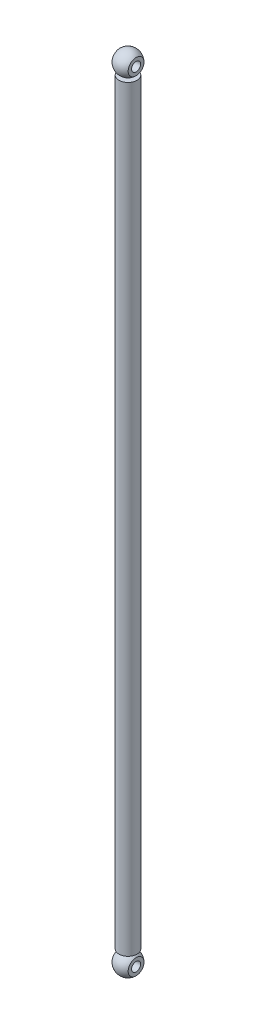
from build123d import *

# Parameters (mm, degrees)
SKETCH_1_W          = 4
SKETCH_1_H          = 334
SKETCH_3_W          = 5.137829835
SKETCH_3_H          = 13.006561537
CUT_EXTRUDE_1_DEPTH = 5
SKETCH_3_3_W        = 5.137829835
SKETCH_3_3_H        = 13.006561537
CUT_EXTRUDE_3_DEPTH = 5
SKETCH_4_R          = 2
CUT_EXTRUDE_4_DEPTH = 10


with BuildPart() as part:
    # 草圖1 → 旋轉1 (revolve)
    with BuildSketch(Plane.XY, mode=Mode.PRIVATE) as revolve_1_sk:
        with Locations((2, 167)):
            Rectangle(SKETCH_1_W, SKETCH_1_H)
    revolve(revolve_1_sk.sketch.rotate(Axis((0, 0, 0), (0, 1, 0)), 90), axis=Axis((0, 0, 0), (0, 1, 0)))


with BuildPart() as body_2:
    # 草圖2 → 旋轉2 (revolve)
    with BuildSketch(Plane.XY):
        with BuildLine():
            Line((0, 0), (0, -10))
            ThreePointArc((0, -10), (5, -5), (0, 0))
        make_face()
        with BuildLine():
            Line((0, 334), (0, 344))
            ThreePointArc((0, 344), (5, 339), (0, 334))
        make_face()
    revolve(axis=Axis((0, 347.589463941, 0), (0, -1, 0)))

    # 草圖3 → 除料-伸長1 (cut, symmetric)
    with BuildSketch(Plane.XY):
        with Locations((-6.143176149, 340.503280769)):
            Rectangle(SKETCH_3_W, SKETCH_3_H)
        with Locations((6.143176149, 340.503280769)):
            Rectangle(SKETCH_3_W, SKETCH_3_H)
    extrude(amount=CUT_EXTRUDE_1_DEPTH, both=True, mode=Mode.SUBTRACT)

    # 草圖3<3> → 除料-伸長3 (cut, symmetric)
    with BuildSketch(Plane.XY):
        with Locations((-6.143176149, 340.503280769)):
            Rectangle(SKETCH_3_3_W, SKETCH_3_3_H)
        with Locations((6.143176149, 340.503280769)):
            Rectangle(SKETCH_3_3_W, SKETCH_3_3_H)
        with Locations((-6.143176149, -6.503280769)):
            Rectangle(SKETCH_3_3_W, SKETCH_3_3_H)
        with Locations((6.143176149, -6.503280769)):
            Rectangle(SKETCH_3_3_W, SKETCH_3_3_H)
    extrude(amount=CUT_EXTRUDE_3_DEPTH, both=True, mode=Mode.SUBTRACT)

    # 草圖4 → 除料-伸長4 (cut)
    with BuildSketch(Plane(origin=(3.574261231, 0, 0), x_dir=(0, 0, -1), z_dir=(1, 0, 0))):
        with Locations((0, 339)):
            Circle(SKETCH_4_R)
        with Locations((0, -5)):
            Circle(SKETCH_4_R)
    extrude(amount=-CUT_EXTRUDE_4_DEPTH, mode=Mode.SUBTRACT)


solid = Compound([part.part, body_2.part])
